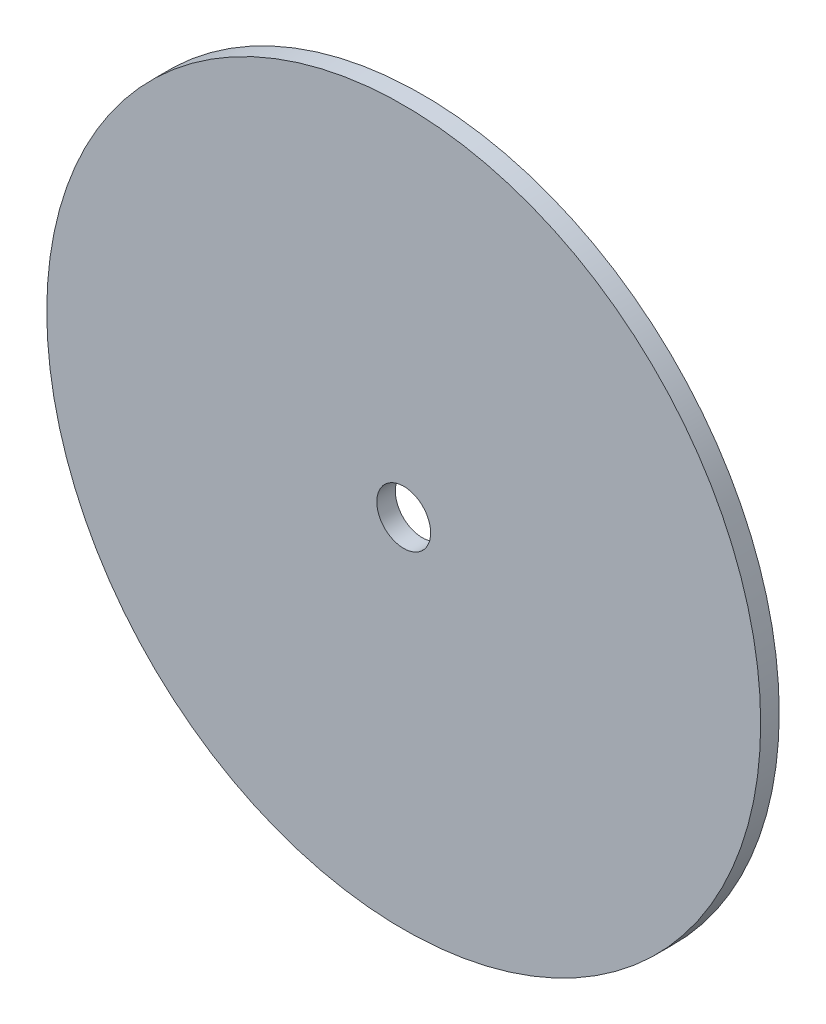
from build123d import *

# Parameters (mm, degrees)
SKETCH1_R           = 59.655
BOSS_EXTRUDE1_DEPTH = 1.55
SKETCH2_R           = 4.5
CUT_EXTRUDE1_DEPTH  = 85.42184581


with BuildPart() as part:
    # Sketch1 → Boss-Extrude1 (new, symmetric)
    with BuildSketch(Plane.XY):
        with Locations(Location((0, 0, 0), (0, 0, 180))):
            Circle(SKETCH1_R)
    extrude(amount=BOSS_EXTRUDE1_DEPTH, both=True)

    # Sketch2 → Cut-Extrude1 (cut, through all)
    with BuildSketch(Plane.XY.offset(1.55)):
        Circle(SKETCH2_R)
    extrude(amount=-CUT_EXTRUDE1_DEPTH, mode=Mode.SUBTRACT)


solid = part.part
